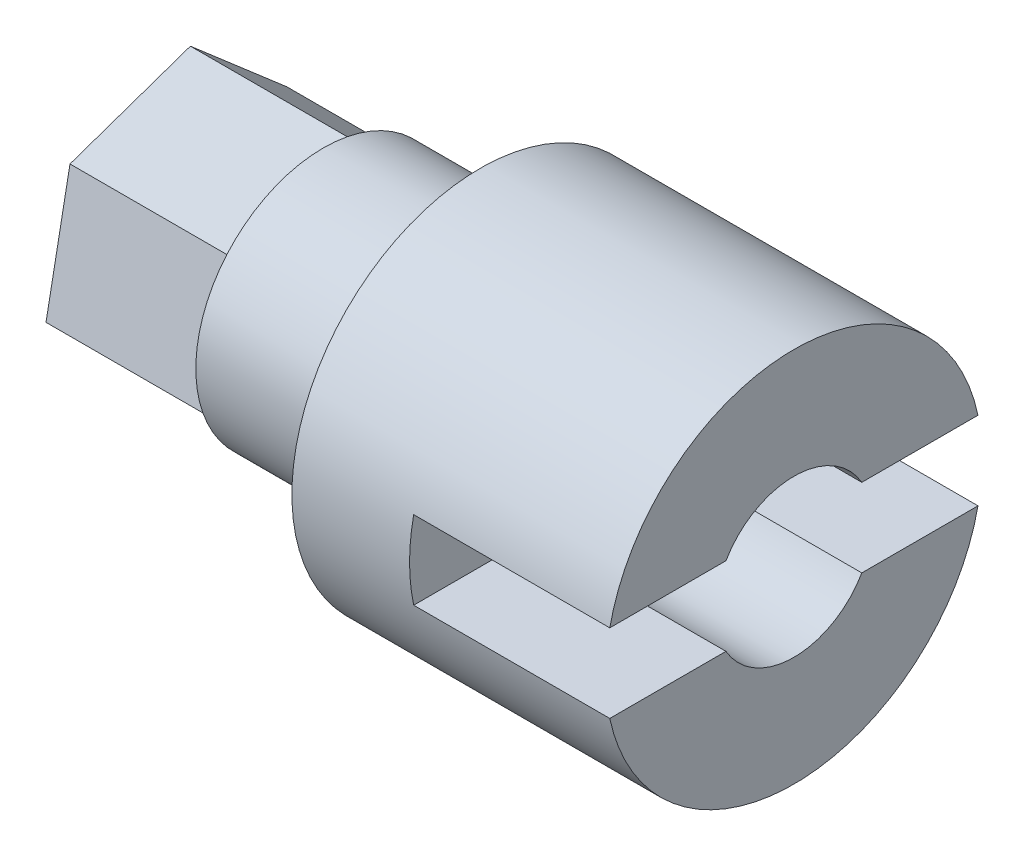
from build123d import *

# Parameters (mm, degrees)
SKETCH_1_R          = 4.8
SKETCH_1_R_2        = 2
EXTRUDE_1_DEPTH     = 8
SKETCH_2_W          = 12
SKETCH_2_H          = 2
CUT_EXTRUDE_1_DEPTH = 5
SKETCH_7_R          = 2
EXTRUDE_4_DEPTH     = 2
SKETCH_8_R          = 3.25
EXTRUDE_5_DEPTH     = 8
SKETCH_9_R          = 1.35
CUT_EXTRUDE_3_DEPTH = 18.380448786
SKETCH_10_OUTSIDE_W = 15.796
SKETCH_10_OUTSIDE_H = 15.796
CUT_EXTRUDE_4_DEPTH = 4


with BuildPart() as part:
    # 草图1 → 凸台-拉伸1 (new body)
    with BuildSketch(Plane(origin=(0, 0, 0), x_dir=(0, 0, -1), z_dir=(1, 0, 0))):
        Circle(SKETCH_1_R)
        Circle(SKETCH_1_R_2, mode=Mode.SUBTRACT)
    extrude(amount=EXTRUDE_1_DEPTH)

    # 草图2 → 切除-拉伸1 (cut)
    with BuildSketch(Plane(origin=(8, 0, 0), x_dir=(0, 0, -1), z_dir=(1, 0, 0))):
        with Locations((0.025285626, 0)):
            Rectangle(SKETCH_2_W, SKETCH_2_H)
    extrude(amount=-CUT_EXTRUDE_1_DEPTH, mode=Mode.SUBTRACT)

    # 草图7 → 凸台-拉伸4 (add)
    with BuildSketch(Plane.ZY):
        Circle(SKETCH_7_R)
    extrude(amount=-EXTRUDE_4_DEPTH)

    # 草图8 → 凸台-拉伸5 (add)
    with BuildSketch(Plane.ZY):
        with Locations(Location((0, 0, 0), (0, 0, 180))):
            Circle(SKETCH_8_R)
    extrude(amount=EXTRUDE_5_DEPTH)

    # 草图9 → 切除-拉伸3 (cut, through all)
    with BuildSketch(Plane.ZY.offset(8)):
        Circle(SKETCH_9_R)
    extrude(amount=-CUT_EXTRUDE_3_DEPTH, mode=Mode.SUBTRACT)

    # 草图10 outside → 切除-拉伸4 (cut)
    with BuildSketch(Plane.ZY.offset(8)):
        Rectangle(SKETCH_10_OUTSIDE_W, SKETCH_10_OUTSIDE_H)
        Polygon((-3.070099371, 1.066297262), (-2.458490203, -2.125635416), (0.611609168, -3.191932679), (3.070099371, -1.066297262), (2.458490203, 2.125635416), (-0.611609168, 3.191932679), align=None, mode=Mode.SUBTRACT)
    extrude(amount=-CUT_EXTRUDE_4_DEPTH, mode=Mode.SUBTRACT)


solid = part.part
